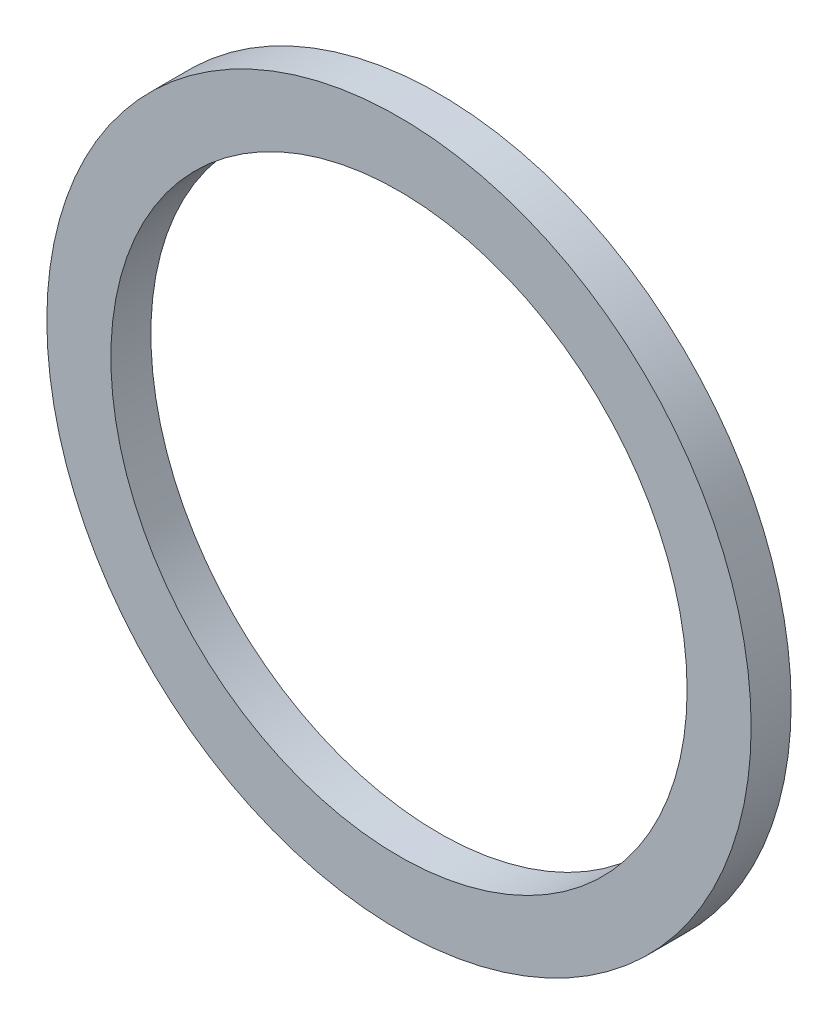
from build123d import *

# Parameters (mm, degrees)
ESQUISSE1_R          = 11
ESQUISSE1_R_2        = 9
BASE_EXTRUSION_DEPTH = 1.25


with BuildPart() as part:
    # Esquisse1 → Base-Extrusion (new body)
    with BuildSketch(Plane.XY):
        Circle(ESQUISSE1_R)
        Circle(ESQUISSE1_R_2, mode=Mode.SUBTRACT)
    extrude(amount=BASE_EXTRUSION_DEPTH)


solid = part.part
